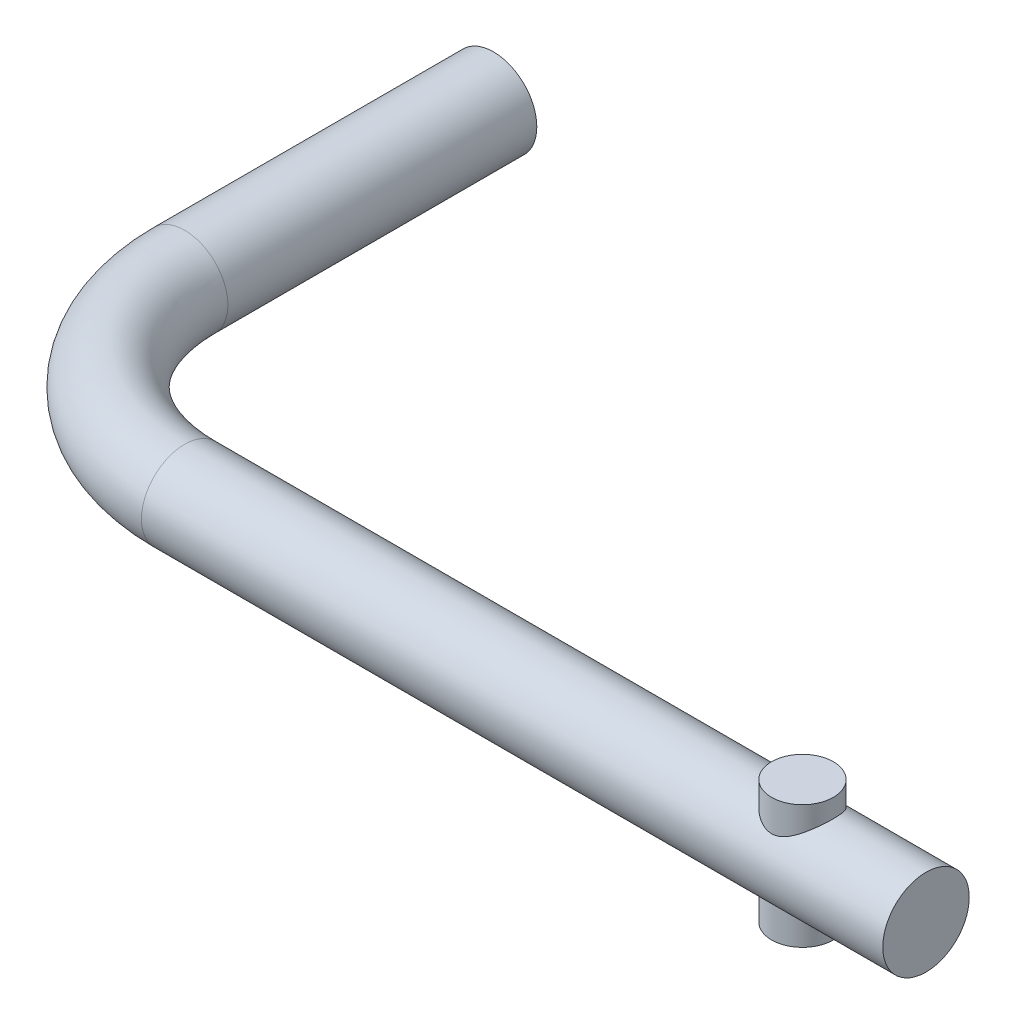
from build123d import *

# Parameters (mm, degrees)
SWEEP1_PROFILE_R         = 7
BOSS_EXTRUDE1_DEPTH      = 10
BOSS_EXTRUDE1_DEPTH_BACK = 10
SKETCH8_R                = 5


with BuildPart() as part:
    # Sweep1: sweep along a path in Sketch1
    with BuildLine(Plane(origin=(0, 0, 0), x_dir=(1, 0, 0), z_dir=(0, 1, 0))) as sweep1_path:
        Line((0, 0), (-120, 0))
        ThreePointArc((-120, 0), (-141.213203436, 8.786796564), (-150, 30))
        Line((-150, 30), (-150, 80))
    # Sweep1 profile (on start of the path) → Sweep1 (sweep)
    with BuildSketch(Plane(origin=(0, 0, 0), x_dir=(0, 0, -1), z_dir=(-1, 0, 0))):
        Circle(SWEEP1_PROFILE_R)
    sweep(path=sweep1_path.line)

    # Sketch8 → Boss-Extrude1 (add, two sides: drawn at the far end of the back side and taken through both)
    with BuildSketch(Plane(origin=(0, 0, 0), x_dir=(1, 0, 0), z_dir=(0, 1, 0)).offset(-BOSS_EXTRUDE1_DEPTH_BACK)):
        with Locations((-20, 0)):
            Circle(SKETCH8_R)
    extrude(amount=BOSS_EXTRUDE1_DEPTH + BOSS_EXTRUDE1_DEPTH_BACK)


solid = part.part
